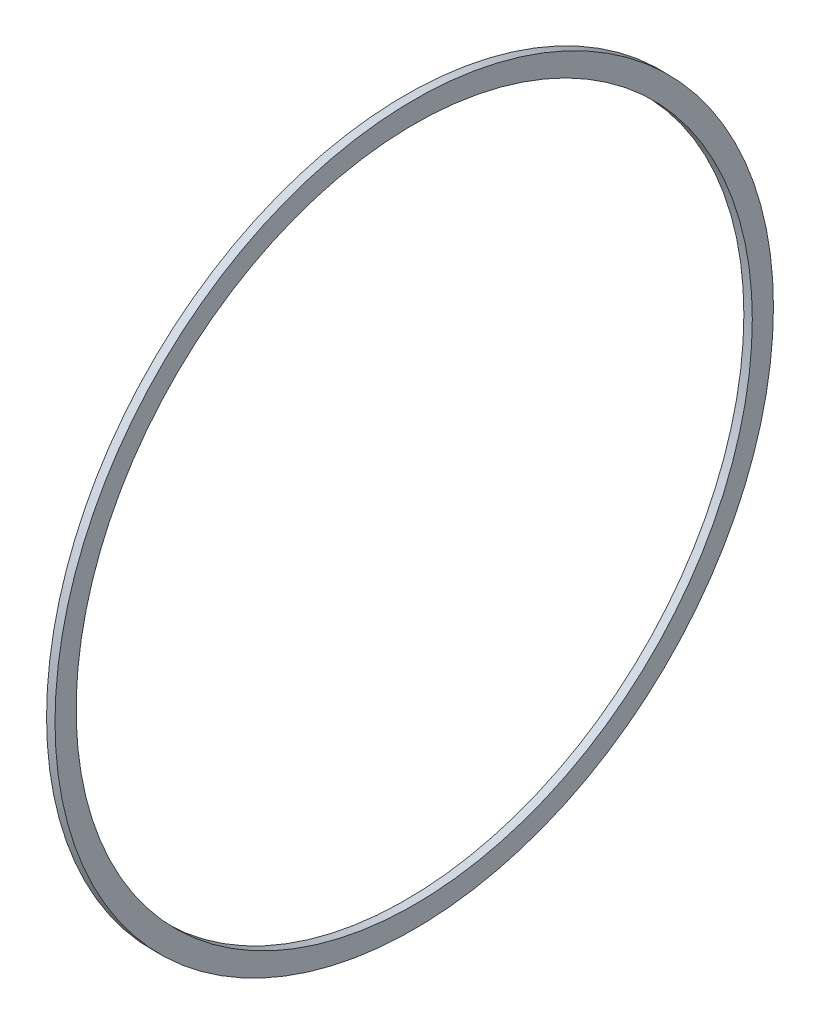
from build123d import *

# Parameters (mm, degrees)
SKETCH1_R           = 42.5
SKETCH1_R_2         = 40
BOSS_EXTRUDE1_DEPTH = 1


with BuildPart() as part:
    # Sketch1 → Boss-Extrude1 (new body)
    with BuildSketch(Plane(origin=(0, 0, 0), x_dir=(0, 0, -1), z_dir=(1, 0, 0))):
        Circle(SKETCH1_R)
        Circle(SKETCH1_R_2, mode=Mode.SUBTRACT)
    extrude(amount=BOSS_EXTRUDE1_DEPTH)


solid = part.part
